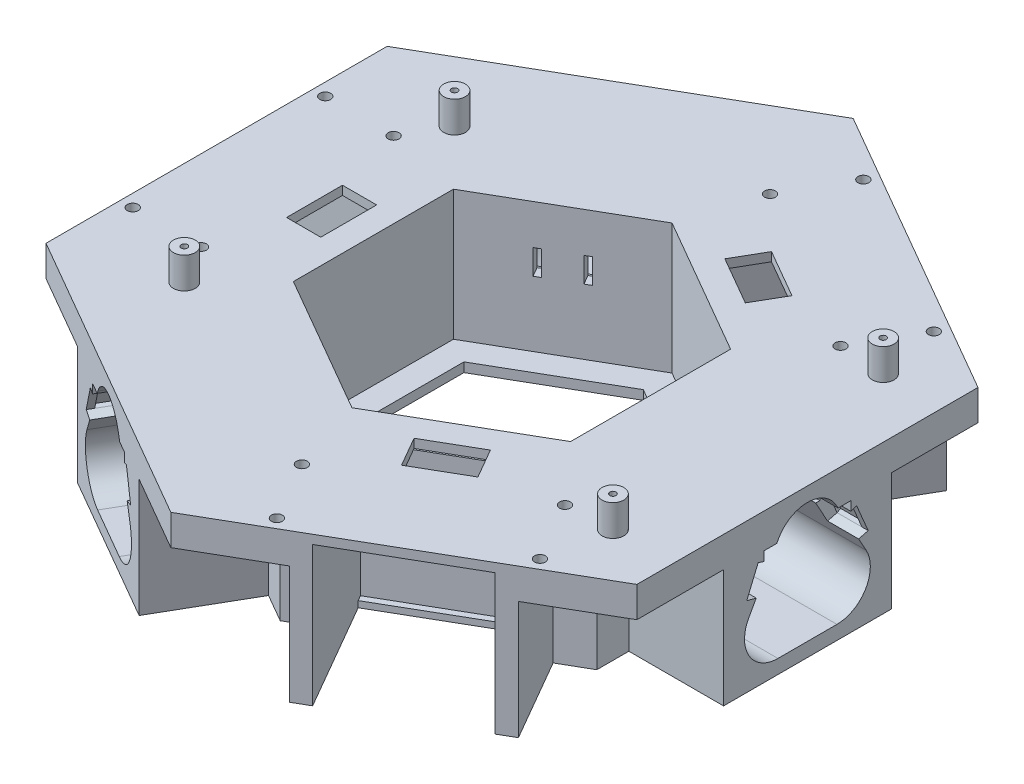
from build123d import *

# Parameters (mm, degrees)
RESSALTO_EXTRUS_O1_DEPTH = 47.85
CORTE_EXTRUS_O1_DEPTH    = 153.974473143
CORTE_EXTRUS_O2_DEPTH    = 41.85
CORTE_EXTRUS_O3_DEPTH    = 3
CORTE_EXTRUS_O4_DEPTH    = 42.04
RESSALTO_EXTRUS_O2_DEPTH = 2
CORTE_EXTRUS_O5_DEPTH    = 42.04
CORTE_EXTRUS_O6_DEPTH    = 42.04
RESSALTO_EXTRUS_O3_DEPTH = 2
RESSALTO_EXTRUS_O4_DEPTH = 2
CORTE_EXTRUS_O7_DEPTH    = 2.85
CORTE_EXTRUS_O8_DEPTH    = 37.5
CORTE_EXTRUS_O9_DEPTH    = 37.5
CORTE_EXTRUS_O10_DEPTH   = 37.5
CORTE_EXTRUS_O11_DEPTH   = 47
CORTE_EXTRUS_O12_DEPTH   = 47
CORTE_EXTRUS_O13_DEPTH   = 47
ESBO_O22_W               = 28
ESBO_O22_H               = 5
CORTE_EXTRUS_O17_DEPTH   = 47
ESBO_O23_W               = 28
ESBO_O23_H               = 5
CORTE_EXTRUS_O18_DEPTH   = 47
ESBO_O24_W               = 28
ESBO_O24_H               = 5
CORTE_EXTRUS_O19_DEPTH   = 47
CORTE_EXTRUS_O20_DEPTH   = 10
CORTE_EXTRUS_O21_DEPTH   = 10
CORTE_EXTRUS_O22_DEPTH   = 10
CORTE_EXTRUS_O23_DEPTH   = 1.5
CORTE_EXTRUS_O23_DRAFT   = 15
CORTE_EXTRUS_O24_DEPTH   = 1.5
CORTE_EXTRUS_O24_DRAFT   = 15
CORTE_EXTRUS_O25_DEPTH   = 1.5
CORTE_EXTRUS_O25_DRAFT   = 15
CORTE_EXTRUS_O26_DEPTH   = 1.5
CORTE_EXTRUS_O26_DRAFT   = 15
ESBO_O32_W               = 8
ESBO_O32_H               = 9.496241362
CORTE_EXTRUS_O27_DEPTH   = 1.5
CORTE_EXTRUS_O27_DRAFT   = 15
ESBO_O33_W               = 8
ESBO_O33_H               = 9.496241362
CORTE_EXTRUS_O28_DEPTH   = 1.5
CORTE_EXTRUS_O28_DRAFT   = 15
ESBO_O34_W               = 2
ESBO_O34_H               = 8
CORTE_EXTRUS_O29_DEPTH   = 78.5
ESBO_O35_W               = 2
ESBO_O35_H               = 8
CORTE_EXTRUS_O30_DEPTH   = 78.5
ESBO_O36_W               = 2
ESBO_O36_H               = 8
CORTE_EXTRUS_O31_DEPTH   = 78.5
CORTE_EXTRUS_O37_DEPTH   = 38
ESBO_O42_R               = 1.75
CORTE_EXTRUS_O38_DEPTH   = 153.974473143
ESBO_O43_R               = 3.5
RESSALTO_EXTRUS_O5_DEPTH = 10
ESBO_O44_R               = 1
CORTE_EXTRUS_O39_DEPTH   = 6


with BuildPart() as part:
    # Esboço1 → Ressalto-extrusão1 (new body)
    with BuildSketch(Plane(origin=(0, 0, 0), x_dir=(1, 0, 0), z_dir=(0, 1, 0))):
        Polygon((-95.12, 54.917557605), (-95.12, -54.917557605), (0, -109.835115211), (95.12, -54.917557605), (95.12, 54.917557605), (0, 109.835115211), align=None)
    extrude(amount=RESSALTO_EXTRUS_O1_DEPTH)

    # Esboço2 → Corte-extrusão1 (cut, through all)
    with BuildSketch(Plane(origin=(0, 47.85, 0), x_dir=(1, 0, 0), z_dir=(0, 1, 0))):
        Polygon((-36.62, 21.142566858), (-36.62, -21.142566858), (0, -42.285133715), (36.62, -21.142566858), (36.62, 21.142566858), (0, 42.285133715), align=None)
    extrude(amount=-CORTE_EXTRUS_O1_DEPTH, mode=Mode.SUBTRACT)

    # Esboço3 → Corte-extrusão2 (cut)
    with BuildSketch(Plane(origin=(0, 47.85, 0), x_dir=(1, 0, 0), z_dir=(0, 1, 0))):
        Polygon((44.62, 25.761369011), (44.62, -25.761369011), (0, -51.522738022), (-44.62, -25.761369011), (-44.62, 25.761369011), (0, 51.522738022), align=None)
    extrude(amount=-CORTE_EXTRUS_O2_DEPTH, mode=Mode.SUBTRACT)

    # Esboço4 → Corte-extrusão3 (cut)
    with BuildSketch(Plane(origin=(0, 0, 0), x_dir=(-1, 0, 0), z_dir=(0, -1, 0))):
        Polygon((-44.62, -25.761369011), (-44.62, 25.761369011), (0, 51.522738022), (44.62, 25.761369011), (44.62, -25.761369011), (0, -51.522738022), align=None)
    extrude(amount=-CORTE_EXTRUS_O3_DEPTH, mode=Mode.SUBTRACT)

    # Esboço5 → Corte-extrusão4 (cut)
    with BuildSketch(Plane.ZY.offset(95.12)):
        Polygon((0, 45), (-21.5, 45), (-21.5, 0), (21.5, 0), (21.5, 45), align=None)
    extrude(amount=-CORTE_EXTRUS_O4_DEPTH, mode=Mode.SUBTRACT)

    # Esboço6 → Ressalto-extrusão2 (add)
    with BuildSketch(Plane.ZY.offset(53.08)):
        Polygon((0, 0), (21.5, 0), (21.5, 2), (-21.5, 2), (-21.5, 0), align=None)
    extrude(amount=RESSALTO_EXTRUS_O2_DEPTH)

    # Esboço7 → Corte-extrusão5 (cut)
    with BuildSketch(Plane(origin=(47.56, 0, -82.376336408), x_dir=(-0.8660254037844387, 0, -0.49999999999999994), z_dir=(0.4999999999999999, 0, -0.8660254037844386))):
        Polygon((0, 45), (21.5, 45), (21.5, 0), (-21.5, 0), (-21.5, 45), align=None)
    extrude(amount=-CORTE_EXTRUS_O5_DEPTH, mode=Mode.SUBTRACT)

    # Esboço8 → Corte-extrusão6 (cut)
    with BuildSketch(Plane(origin=(47.56, 0, 82.376336408), x_dir=(0.8660254037844386, 0, -0.5000000000000003), z_dir=(0.5000000000000003, 0, 0.8660254037844386))):
        Polygon((0, 45), (21.5, 45), (21.5, 0), (-21.5, 0), (-21.5, 45), align=None)
    extrude(amount=-CORTE_EXTRUS_O6_DEPTH, mode=Mode.SUBTRACT)

    # Esboço9 → Ressalto-extrusão3 (add)
    with BuildSketch(Plane(origin=(26.54, 0, 45.968628433), x_dir=(0.8660254037844384, 0, -0.5000000000000006), z_dir=(0.5000000000000006, 0, 0.8660254037844384))):
        Polygon((0, 0), (21.5, 0), (21.5, 2), (-21.5, 2), (-21.5, 0), align=None)
    extrude(amount=RESSALTO_EXTRUS_O3_DEPTH)

    # Esboço10 → Ressalto-extrusão4 (add)
    with BuildSketch(Plane(origin=(26.54, 0, -45.968628433), x_dir=(-0.8660254037844387, 0, -0.49999999999999983), z_dir=(0.49999999999999983, 0, -0.8660254037844387))):
        Polygon((0, 0), (21.5, 0), (21.5, 2), (-21.5, 2), (-21.5, 0), align=None)
    extrude(amount=RESSALTO_EXTRUS_O4_DEPTH)

    # Esboço11 → Corte-extrusão7 (cut)
    with BuildSketch(Plane(origin=(0, 47.85, 0), x_dir=(1, 0, 0), z_dir=(0, 1, 0))):
        Polygon((-52.58, 0), (-52.58, 9), (-63.58, 9), (-63.58, -9), (-52.58, -9), align=None)
        Polygon((26.29, 45.535615731), (34.084228634, 41.035615731), (39.584228634, 50.561895173), (23.995771366, 59.561895173), (18.495771366, 50.035615731), align=None)
        Polygon((26.29, -45.535615731), (18.495771366, -50.035615731), (23.995771366, -59.561895173), (39.584228634, -50.561895173), (34.084228634, -41.035615731), align=None)
    extrude(amount=-CORTE_EXTRUS_O7_DEPTH, mode=Mode.SUBTRACT)

    # Esboço12 → Corte-extrusão8 (cut)
    with BuildSketch(Plane(origin=(95.12, 0, 0), x_dir=(0, 0, -1), z_dir=(1, 0, 0))):
        with BuildLine():
            Line((-9.315367954, 37.762017036), (-18.902836198, 20.460486679))
            ThreePointArc((-18.902836198, 20.460486679), (-18.762160434, 9.793363298), (-9.5, 4.5))
            Line((-9.5, 4.5), (9.5, 4.5))
            ThreePointArc((9.5, 4.5), (18.762160434, 9.793363298), (18.902836198, 20.460486679))
            Line((18.902836198, 20.460486679), (9.315367954, 37.762017036))
            ThreePointArc((9.315367954, 37.762017036), (0, 43.25), (-9.315367954, 37.762017036))
        make_face()
    extrude(amount=-CORTE_EXTRUS_O8_DEPTH, mode=Mode.SUBTRACT)

    # Esboço13 → Corte-extrusão9 (cut)
    with BuildSketch(Plane(origin=(-47.56, 0, 82.376336408), x_dir=(0.8660254037844386, 0, 0.5000000000000003), z_dir=(-0.5000000000000002, 0, 0.8660254037844385))):
        with BuildLine():
            Line((-9.315367954, 37.762017036), (-18.902836198, 20.460486679))
            ThreePointArc((-18.902836198, 20.460486679), (-18.762160434, 9.793363298), (-9.5, 4.5))
            Line((-9.5, 4.5), (9.5, 4.5))
            ThreePointArc((9.5, 4.5), (18.762160434, 9.793363298), (18.902836198, 20.460486679))
            Line((18.902836198, 20.460486679), (9.315367954, 37.762017036))
            ThreePointArc((9.315367954, 37.762017036), (0, 43.25), (-9.315367954, 37.762017036))
        make_face()
    extrude(amount=-CORTE_EXTRUS_O9_DEPTH, mode=Mode.SUBTRACT)

    # Esboço14 → Corte-extrusão10 (cut)
    with BuildSketch(Plane(origin=(-47.56, 0, -82.376336408), x_dir=(-0.8660254037844386, 0, 0.5000000000000003), z_dir=(-0.5000000000000002, 0, -0.8660254037844385))):
        with BuildLine():
            Line((-9.315367954, 37.762017036), (-18.902836198, 20.460486679))
            ThreePointArc((-18.902836198, 20.460486679), (-18.762160434, 9.793363298), (-9.5, 4.5))
            Line((-9.5, 4.5), (9.5, 4.5))
            ThreePointArc((9.5, 4.5), (18.762160434, 9.793363298), (18.902836198, 20.460486679))
            Line((18.902836198, 20.460486679), (9.315367954, 37.762017036))
            ThreePointArc((9.315367954, 37.762017036), (0, 43.25), (-9.315367954, 37.762017036))
        make_face()
    extrude(amount=-CORTE_EXTRUS_O10_DEPTH, mode=Mode.SUBTRACT)

    # Esboço15 → Corte-extrusão11 (cut)
    with BuildSketch(Plane(origin=(95.12, 0, 0), x_dir=(0, 0, -1), z_dir=(1, 0, 0))):
        with BuildLine():
            Line((-9.315367954, 37.762017036), (-18.88094029, 20.5))
            Line((-18.88094029, 20.5), (18.88094029, 20.5))
            Line((18.88094029, 20.5), (9.315367954, 37.762017036))
            ThreePointArc((9.315367954, 37.762017036), (0, 43.25), (-9.315367954, 37.762017036))
        make_face()
    extrude(amount=-CORTE_EXTRUS_O11_DEPTH, mode=Mode.SUBTRACT)

    # Esboço16 → Corte-extrusão12 (cut)
    with BuildSketch(Plane(origin=(-47.56, 0, -82.376336408), x_dir=(-0.8660254037844386, 0, 0.5000000000000003), z_dir=(-0.5000000000000002, 0, -0.8660254037844385))):
        with BuildLine():
            Line((9.315367954, 37.762017036), (18.902836198, 20.460486679))
            ThreePointArc((18.902836198, 20.460486679), (18.891854639, 20.480254912), (18.880831519, 20.500000001))
            Line((18.880831519, 20.500000001), (-18.88083152, 20.500000001))
            ThreePointArc((-18.88083152, 20.500000001), (-18.89185464, 20.480254911), (-18.9028362, 20.460486677))
            Line((-18.9028362, 20.460486677), (-9.315367954, 37.762017036))
            ThreePointArc((-9.315367954, 37.762017036), (0, 43.25), (9.315367954, 37.762017036))
        make_face()
    extrude(amount=-CORTE_EXTRUS_O12_DEPTH, mode=Mode.SUBTRACT)

    # Esboço17 → Corte-extrusão13 (cut)
    with BuildSketch(Plane(origin=(-47.56, 0, 82.376336408), x_dir=(0.8660254037844386, 0, 0.5000000000000003), z_dir=(-0.5000000000000002, 0, 0.8660254037844385))):
        with BuildLine():
            Line((-9.315367954, 37.762017036), (-18.88094029, 20.5))
            Line((-18.88094029, 20.5), (18.88094029, 20.5))
            Line((18.88094029, 20.5), (9.315367954, 37.762017036))
            ThreePointArc((9.315367954, 37.762017036), (0, 43.25), (-9.315367954, 37.762017036))
        make_face()
    extrude(amount=-CORTE_EXTRUS_O13_DEPTH, mode=Mode.SUBTRACT)

    # Esboço22 → Corte-extrusão17 (cut)
    with BuildSketch(Plane(origin=(95.12, 0, 0), x_dir=(0, 0, -1), z_dir=(1, 0, 0))):
        with Locations((0, 34.25)):
            Rectangle(ESBO_O22_W, ESBO_O22_H)
    extrude(amount=-CORTE_EXTRUS_O17_DEPTH, mode=Mode.SUBTRACT)

    # Esboço23 → Corte-extrusão18 (cut)
    with BuildSketch(Plane(origin=(-47.56, 0, -82.376336408), x_dir=(-0.8660254037844386, 0, 0.5000000000000003), z_dir=(-0.5000000000000002, 0, -0.8660254037844385))):
        with Locations((0, 34.25)):
            Rectangle(ESBO_O23_W, ESBO_O23_H)
    extrude(amount=-CORTE_EXTRUS_O18_DEPTH, mode=Mode.SUBTRACT)

    # Esboço24 → Corte-extrusão19 (cut)
    with BuildSketch(Plane(origin=(-47.56, 0, 82.376336408), x_dir=(0.8660254037844386, 0, 0.5000000000000003), z_dir=(-0.5000000000000002, 0, 0.8660254037844385))):
        with Locations((0, 34.25)):
            Rectangle(ESBO_O24_W, ESBO_O24_H)
    extrude(amount=-CORTE_EXTRUS_O19_DEPTH, mode=Mode.SUBTRACT)

    # Esboço25 → Corte-extrusão20 (cut)
    with BuildSketch(Plane(origin=(95.12, 0, 0), x_dir=(0, 0, -1), z_dir=(1, 0, 0))):
        Polygon((-15.86, 34.37), (0, 29.25), (15.86, 34.37), (19.55, 25.62), (0, 20.5), (-19.55, 25.62), align=None)
    extrude(amount=-CORTE_EXTRUS_O20_DEPTH, mode=Mode.SUBTRACT)

    # Esboço26 → Corte-extrusão21 (cut)
    with BuildSketch(Plane(origin=(-47.56, 0, -82.376336408), x_dir=(-0.8660254037844386, 0, 0.5000000000000003), z_dir=(-0.5000000000000002, 0, -0.8660254037844385))):
        Polygon((-15.86, 34.37), (0, 29.250000001), (15.86, 34.37), (19.55, 25.62), (0, 20.500000001), (-19.55, 25.62), align=None)
    extrude(amount=-CORTE_EXTRUS_O21_DEPTH, mode=Mode.SUBTRACT)

    # Esboço27 → Corte-extrusão22 (cut)
    with BuildSketch(Plane(origin=(-47.56, 0, 82.376336408), x_dir=(0.8660254037844386, 0, 0.5000000000000003), z_dir=(-0.5000000000000002, 0, 0.8660254037844385))):
        Polygon((-15.86, 34.37), (0, 29.250000001), (15.86, 34.37), (19.55, 25.62), (0, 20.500000001), (-19.55, 25.62), align=None)
    extrude(amount=-CORTE_EXTRUS_O22_DEPTH, mode=Mode.SUBTRACT)


with BuildPart() as corte_extrus_o23_tool:
    # Esboço28 → Corte-extrusão23 (with draft: the straight prism first)
    with BuildSketch(Plane(origin=(22.318435989, 10.868045268, -12.885555026), x_dir=(0.4142091718091397, 0.20170069407025842, 0.8875514587902849), z_dir=(-0.7979706911896647, -0.38857479074568324, 0.460708593363785))):
        Polygon((-87.356884839, 36.005991862), (-79.550911268, 34.2547704), (-77.472158558, 43.520696537), (-85.278132129, 45.271917999), align=None)
    extrude(amount=-CORTE_EXTRUS_O23_DEPTH)
    # Corte-extrusão23: the draft: its side faces are tilted about the plane it starts from
    corte_extrus_o23_sides = [corte_extrus_o23_tool.faces().sort_by_distance(p)[0] for p in [
        (-27.030725338, 25.911431093, -87.30071543),
        (-26.628542208, 30.286431093, -82.914113815),
        (-30.226359078, 34.661431093, -85.45571543),
        (-30.628542208, 30.286431093, -89.842317045),
    ]]
    draft(corte_extrus_o23_sides, Plane(origin=(22.318435989, 10.868045268, -12.885555026), x_dir=(0.4142091718091397, 0.20170069407025842, 0.8875514587902849), z_dir=(-0.7979706911896647, -0.38857479074568324, 0.460708593363785)), CORTE_EXTRUS_O23_DRAFT)


with BuildPart() as part_1:
    add(part.part)

    # Corte-extrusão23: cut by corte_extrus_o23_tool
    add(corte_extrus_o23_tool.part, mode=Mode.SUBTRACT)


with BuildPart() as corte_extrus_o24_tool:
    # Esboço29 → Corte-extrusão24 (with draft: the straight prism first)
    with BuildSketch(Plane(origin=(-22.318435989, 10.868045268, 12.885555026), x_dir=(-0.41420917180913963, 0.2017006940702585, -0.8875514587902849), z_dir=(0.7979706911896646, -0.3885747907456835, -0.460708593363785))):
        Polygon((94.366179896, -4.762443766), (96.444932605, 4.503482371), (88.638959034, 6.254703832), (86.560206324, -3.011222304), align=None)
    extrude(amount=-CORTE_EXTRUS_O24_DEPTH)
    # Corte-extrusão24: the draft: its side faces are tilted about the plane it starts from
    corte_extrus_o24_sides = [corte_extrus_o24_tool.faces().sort_by_distance(p)[0] for p in [
        (-62.491457792, 30.286431093, -71.446254155),
        (-58.893640922, 34.661431093, -68.90465254),
        (-58.491457792, 30.286431093, -64.518050925),
        (-62.089274662, 25.911431093, -67.05965254),
    ]]
    draft(corte_extrus_o24_sides, Plane(origin=(-22.318435989, 10.868045268, 12.885555026), x_dir=(-0.41420917180913963, 0.2017006940702585, -0.8875514587902849), z_dir=(0.7979706911896646, -0.3885747907456835, -0.460708593363785)), CORTE_EXTRUS_O24_DRAFT)


with BuildPart() as part_2:
    add(part_1.part)

    # Corte-extrusão24: cut by corte_extrus_o24_tool
    add(corte_extrus_o24_tool.part, mode=Mode.SUBTRACT)


with BuildPart() as corte_extrus_o25_tool:
    # Esboço30 → Corte-extrusão25 (with draft: the straight prism first)
    with BuildSketch(Plane(origin=(-22.318435989, 10.868045268, -12.885555026), x_dir=(0.41420917180913963, -0.2017006940702585, -0.8875514587902849), z_dir=(0.7979706911896646, -0.3885747907456835, 0.460708593363785))):
        Polygon((-94.366179896, -4.762443766), (-86.560206324, -3.011222304), (-88.638959034, 6.254703832), (-96.444932605, 4.503482371), align=None)
    extrude(amount=-CORTE_EXTRUS_O25_DEPTH)
    # Corte-extrusão25: the draft: its side faces are tilted about the plane it starts from
    corte_extrus_o25_sides = [corte_extrus_o25_tool.faces().sort_by_distance(p)[0] for p in [
        (-62.089274662, 25.911431093, 67.05965254),
        (-58.491457792, 30.286431093, 64.518050925),
        (-58.893640922, 34.661431093, 68.90465254),
        (-62.491457792, 30.286431093, 71.446254155),
    ]]
    draft(corte_extrus_o25_sides, Plane(origin=(-22.318435989, 10.868045268, -12.885555026), x_dir=(0.41420917180913963, -0.2017006940702585, -0.8875514587902849), z_dir=(0.7979706911896646, -0.3885747907456835, 0.460708593363785)), CORTE_EXTRUS_O25_DRAFT)


with BuildPart() as part_3:
    add(part_2.part)

    # Corte-extrusão25: cut by corte_extrus_o25_tool
    add(corte_extrus_o25_tool.part, mode=Mode.SUBTRACT)


with BuildPart() as corte_extrus_o26_tool:
    # Esboço31 → Corte-extrusão26 (with draft: the straight prism first)
    with BuildSketch(Plane(origin=(22.318435989, 10.868045268, 12.885555026), x_dir=(-0.41420917180913985, -0.20170069407025834, 0.8875514587902849), z_dir=(-0.7979706911896647, -0.388574790745683, -0.46070859336378506))):
        Polygon((85.278132129, 45.271917999), (77.472158558, 43.520696537), (79.550911268, 34.2547704), (87.356884839, 36.005991862), align=None)
    extrude(amount=-CORTE_EXTRUS_O26_DEPTH)
    # Corte-extrusão26: the draft: its side faces are tilted about the plane it starts from
    corte_extrus_o26_sides = [corte_extrus_o26_tool.faces().sort_by_distance(p)[0] for p in [
        (-30.226359078, 34.661431093, 85.45571543),
        (-26.628542208, 30.286431093, 82.914113815),
        (-27.030725338, 25.911431093, 87.30071543),
        (-30.628542208, 30.286431093, 89.842317045),
    ]]
    draft(corte_extrus_o26_sides, Plane(origin=(22.318435989, 10.868045268, 12.885555026), x_dir=(-0.41420917180913985, -0.20170069407025834, 0.8875514587902849), z_dir=(-0.7979706911896647, -0.388574790745683, -0.46070859336378506)), CORTE_EXTRUS_O26_DRAFT)


with BuildPart() as part_4:
    add(part_3.part)

    # Corte-extrusão26: cut by corte_extrus_o26_tool
    add(corte_extrus_o26_tool.part, mode=Mode.SUBTRACT)


with BuildPart() as corte_extrus_o27_tool:
    # Esboço32 → Corte-extrusão27 (with draft: the straight prism first)
    with BuildSketch(Plane(origin=(0, 10.868045268, -25.771110053), x_dir=(1, 0, 0), z_dir=(0, -0.3885747907456834, 0.9214171867275693))):
        with Locations((89.12, 20.758191846)):
            Rectangle(ESBO_O32_W, ESBO_O32_H)
    extrude(amount=-CORTE_EXTRUS_O27_DEPTH)
    # Corte-extrusão27: the draft: its side faces are tilted about the plane it starts from
    corte_extrus_o27_sides = [corte_extrus_o27_tool.faces().sort_by_distance(p)[0] for p in [
        (93.12, 30.286431093, -18.39606289),
        (89.12, 34.661431093, -16.55106289),
        (85.12, 30.286431093, -18.39606289),
        (89.12, 25.911431093, -20.24106289),
    ]]
    draft(corte_extrus_o27_sides, Plane(origin=(0, 10.868045268, -25.771110053), x_dir=(1, 0, 0), z_dir=(0, -0.3885747907456834, 0.9214171867275693)), CORTE_EXTRUS_O27_DRAFT)


with BuildPart() as part_5:
    add(part_4.part)

    # Corte-extrusão27: cut by corte_extrus_o27_tool
    add(corte_extrus_o27_tool.part, mode=Mode.SUBTRACT)


with BuildPart() as corte_extrus_o28_tool:
    # Esboço33 → Corte-extrusão28 (with draft: the straight prism first)
    with BuildSketch(Plane(origin=(0, 10.868045268, 25.771110053), x_dir=(-1, 0, 0), z_dir=(0, -0.38857479074568413, -0.921417186727569))):
        with Locations((-89.12, 20.758191846)):
            Rectangle(ESBO_O33_W, ESBO_O33_H)
    extrude(amount=-CORTE_EXTRUS_O28_DEPTH)
    # Corte-extrusão28: the draft: its side faces are tilted about the plane it starts from
    corte_extrus_o28_sides = [corte_extrus_o28_tool.faces().sort_by_distance(p)[0] for p in [
        (85.12, 30.286431093, 18.39606289),
        (89.12, 34.661431093, 16.55106289),
        (93.12, 30.286431093, 18.39606289),
        (89.12, 25.911431093, 20.24106289),
    ]]
    draft(corte_extrus_o28_sides, Plane(origin=(0, 10.868045268, 25.771110053), x_dir=(-1, 0, 0), z_dir=(0, -0.38857479074568413, -0.921417186727569)), CORTE_EXTRUS_O28_DRAFT)


with BuildPart() as part_6:
    add(part_5.part)

    # Corte-extrusão28: cut by corte_extrus_o28_tool
    add(corte_extrus_o28_tool.part, mode=Mode.SUBTRACT)

    # Esboço34 → Corte-extrusão29 (cut)
    with BuildSketch(Plane(origin=(95.12, 0, 0), x_dir=(0, 0, -1), z_dir=(1, 0, 0))):
        with Locations((-6, 31)):
            Rectangle(ESBO_O34_W, ESBO_O34_H)
        with Locations((6, 31)):
            Rectangle(ESBO_O34_W, ESBO_O34_H)
    extrude(amount=-CORTE_EXTRUS_O29_DEPTH, mode=Mode.SUBTRACT)

    # Esboço35 → Corte-extrusão30 (cut)
    with BuildSketch(Plane(origin=(-47.56, 0, -82.376336408), x_dir=(-0.8660254037844386, 0, 0.5000000000000003), z_dir=(-0.5000000000000002, 0, -0.8660254037844385))):
        with Locations((-6, 31)):
            Rectangle(ESBO_O35_W, ESBO_O35_H)
        with Locations((6, 31)):
            Rectangle(ESBO_O35_W, ESBO_O35_H)
    extrude(amount=-CORTE_EXTRUS_O30_DEPTH, mode=Mode.SUBTRACT)

    # Esboço36 → Corte-extrusão31 (cut)
    with BuildSketch(Plane(origin=(-47.56, 0, 82.376336408), x_dir=(0.8660254037844386, 0, 0.5000000000000003), z_dir=(-0.5000000000000002, 0, 0.8660254037844385))):
        with Locations((-6, 31)):
            Rectangle(ESBO_O36_W, ESBO_O36_H)
        with Locations((6, 31)):
            Rectangle(ESBO_O36_W, ESBO_O36_H)
    extrude(amount=-CORTE_EXTRUS_O31_DEPTH, mode=Mode.SUBTRACT)

    # Esboço38 → Corte-extrusão37 (cut)
    with BuildSketch(Plane(origin=(0, 0, 0), x_dir=(-1, 0, 0), z_dir=(0, -1, 0))):
        Polygon((-8.927314098, 69.462561593), (0, 74.61674879), (8.927314098, 69.462561593), (40.030647431, 123.335115211), (18.309407452, 159.839588634), (-48.99486696, 151.980178412), (-101.301590853, 133.332712728), (-152.343164681, 37.308374395), (-152.343164681, -27), (-135.367685756, -74.61674879), (-101.301590853, -126.108710312), (-79.337280437, -147.887013534), (8.927314098, -147.887013534), (86.796019236, -138.793949202), (119.671066593, -105.638118019), (144.165227035, -63.212987645), (157.565931851, 0), (144.165227035, 53.198628844), (86.796019236, 96.335115211), (55.692685902, 42.462561593), (64.62, 37.308374395), (64.62, 27), (126.826666667, 27), (126.826666667, -27), (64.62, -27), (64.62, -37.308374395), (55.692685902, -42.462561593), (86.796019236, -96.335115211), (40.030647431, -123.335115211), (8.927314098, -69.462561593), (0, -74.61674879), (-8.927314098, -69.462561593), (-40.030647431, -123.335115211), (-86.796019236, -96.335115211), (-55.692685902, -42.462561593), (-64.62, -37.308374395), (-64.62, -27), (-126.826666667, -27), (-126.826666667, 27), (-64.62, 27), (-64.62, 37.308374395), (-55.692685902, 42.462561593), (-86.796019235, 96.335115211), (-40.030647431, 123.335115211), align=None)
    extrude(amount=-CORTE_EXTRUS_O37_DEPTH, mode=Mode.SUBTRACT)

    # Esboço42 → Corte-extrusão38 (cut, through all)
    with BuildSketch(Plane(origin=(0, 47.85, 0), x_dir=(1, 0, 0), z_dir=(0, 1, 0))):
        with Locations(Location((18.713212483, 94.412234793, 0), (0, 0, 270))):
            Circle(ESBO_O42_R)
        with Locations(Location((61.406787517, -44.35967591, 0), (0, 0, 270))):
            Circle(ESBO_O42_R)
        with Locations(Location((-91.12, 31, 0), (0, 0, 270))):
            Circle(ESBO_O42_R)
        with Locations(Location((18.713212483, -94.412234793, 0), (0, 0, 270))):
            Circle(ESBO_O42_R)
        with Locations(Location((-91.12, -31, 0), (0, 0, 270))):
            Circle(ESBO_O42_R)
        with Locations(Location((7.713212483, -75.35967591, 0), (0, 0, 270))):
            Circle(ESBO_O42_R)
        with Locations(Location((72.406787517, -63.412234793, 0), (0, 0, 270))):
            Circle(ESBO_O42_R)
        with Locations(Location((-69.12, 31, 0), (0, 0, 270))):
            Circle(ESBO_O42_R)
        with Locations(Location((61.406787517, 44.35967591, 0), (0, 0, 270))):
            Circle(ESBO_O42_R)
        with Locations(Location((7.713212483, 75.35967591, 0), (0, 0, 270))):
            Circle(ESBO_O42_R)
        with Locations(Location((-69.12, -31, 0), (0, 0, 270))):
            Circle(ESBO_O42_R)
        with Locations(Location((72.406787517, 63.412234793, 0), (0, 0, 270))):
            Circle(ESBO_O42_R)
    extrude(amount=-CORTE_EXTRUS_O38_DEPTH, mode=Mode.SUBTRACT)

    # Esboço43 → Ressalto-extrusão5 (add)
    with BuildSketch(Plane(origin=(0, 47.85, 0), x_dir=(1, 0, 0), z_dir=(0, 1, 0))):
        with Locations(Location((-62, 43.5, 0), (0, 0, 270))):
            Circle(ESBO_O43_R)
        with Locations(Location((76, 43.5, 0), (0, 0, 270))):
            Circle(ESBO_O43_R)
        with Locations(Location((-62, -43.5, 0), (0, 0, 270))):
            Circle(ESBO_O43_R)
        with Locations(Location((76, -43.5, 0), (0, 0, 270))):
            Circle(ESBO_O43_R)
    extrude(amount=RESSALTO_EXTRUS_O5_DEPTH)

    # Esboço44 → Corte-extrusão39 (cut)
    with BuildSketch(Plane(origin=(0, 57.85, 0), x_dir=(1, 0, 0), z_dir=(0, 1, 0))):
        with Locations(Location((-62, 43.5, 0), (0, 0, 270))):
            Circle(ESBO_O44_R)
        with Locations(Location((-62, -43.5, 0), (0, 0, 270))):
            Circle(ESBO_O44_R)
        with Locations(Location((76, -43.5, 0), (0, 0, 270))):
            Circle(ESBO_O44_R)
        with Locations(Location((76, 43.5, 0), (0, 0, 270))):
            Circle(ESBO_O44_R)
    extrude(amount=-CORTE_EXTRUS_O39_DEPTH, mode=Mode.SUBTRACT)


solid = part_6.part
